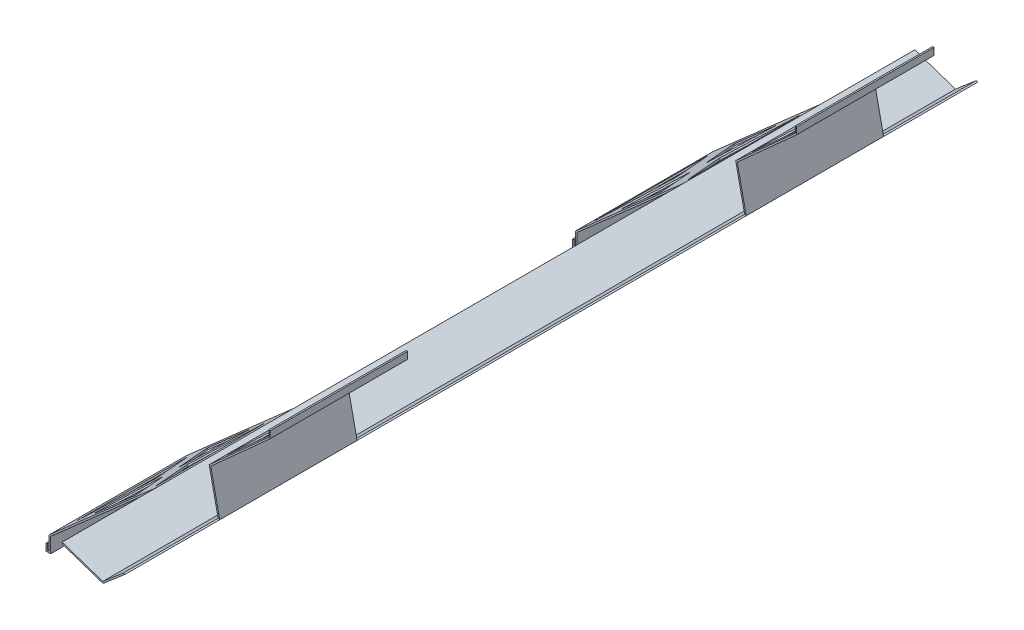
from build123d import *

# Parameters (mm, degrees)
BOSS_EXTRUDE1_DEPTH      = 480
CUT_EXTRUDE3_DEPTH       = 505
CUT_EXTRUDE3_DEPTH_BACK  = 505
BOSS_EXTRUDE2_DEPTH      = 1360
BOSS_EXTRUDE2_DEPTH_BACK = 810
BOSS_EXTRUDE3_DEPTH      = 480
BOSS_EXTRUDE4_DEPTH      = 330
CUT_EXTRUDE4_DEPTH       = 330
CUT_EXTRUDE4_DEPTH_BACK  = 330


with BuildPart() as part:
    # Sketch1 → Boss-Extrude1 (new body)
    with BuildSketch(Plane.XY):
        Polygon((11, 5), (11, 55), (386.170144681, 385.525887852), (528.318811029, 337.632708219), (601.499421829, 400.354983269), (570.353242625, 547.085741874), (778.485595709, 734.384763761), (778.549738756, 756.650357197), (783.549656083, 756.621450914), (783.378536091, 732.061448595), (575.84367641, 545.300113082), (607.006700625, 398.489997031), (529.415153906, 331.987158619), (387.309357719, 379.865894301), (16, 52.741369955), (16, 0), (0, 0), (0, 25), (5, 25), (5, 5), align=None)
    extrude(amount=BOSS_EXTRUDE1_DEPTH)

    # Sketch2 → Cut-Extrude3 (cut, two sides: drawn at the far end of the back side and taken through both)
    with BuildSketch(Plane(origin=(-16.817823624, 18.688475623, 0), x_dir=(0.7433298324443945, 0.6689250781651025, 0), z_dir=(-0.6689250781651025, 0.7433298324443945, 0)).offset(-CUT_EXTRUDE3_DEPTH_BACK)):
        Polygon((194.967507456, -40), (394.939723607, -40), (294.953615531, -213.181019237), align=None)
        Polygon((394.939723607, -440), (294.953615531, -266.818980763), (194.967507456, -440), align=None)
        Polygon((78.387816928, -38.078052875), (78.387816928, -441.921947125), (194.967507456, -240), align=None)
        Polygon((511.519414135, -441.921947125), (394.939723607, -240), (511.519414135, -38.078052875), align=None)
        Polygon((808.395249794, -38.078052875), (1044.692404937, -38.078052875), (926.543827366, -185.27928203), align=None)
        Polygon((1044.692404937, -441.921947125), (926.543827366, -294.72071797), (808.395249794, -441.921947125), align=None)
    extrude(amount=CUT_EXTRUDE3_DEPTH + CUT_EXTRUDE3_DEPTH_BACK, mode=Mode.SUBTRACT)

    # Sketch3 → Boss-Extrude2 (add, two sides: drawn at the far end of the back side and taken through both)
    with BuildSketch(Plane.XY.offset(480).offset(-BOSS_EXTRUDE2_DEPTH_BACK)):
        Polygon((386.170144681, 385.525887852), (528.318811029, 337.632708219), (601.499421829, 400.354983269), (607.006700625, 398.489997031), (529.415153906, 331.987158619), (387.309357719, 379.865894301), align=None)
    extrude(amount=BOSS_EXTRUDE2_DEPTH + BOSS_EXTRUDE2_DEPTH_BACK)

    # Sketch4 → Boss-Extrude3 (add)
    with BuildSketch(Plane.XY.offset(1840)):
        Polygon((0, 25), (5, 25), (5, 5), (11, 5), (11, 55), (386.170144681, 385.525887852), (528.318811029, 337.632708219), (601.499421829, 400.354983269), (570.353242625, 547.085741874), (778.485595709, 734.384763761), (778.549738756, 756.650357197), (783.549656083, 756.621450914), (783.378536091, 732.061448595), (575.84367641, 545.300113082), (607.006700625, 398.489997031), (529.415153906, 331.987158619), (387.309357719, 379.865894301), (16, 52.741369955), (16, 0), (0, 0), align=None)
    extrude(amount=BOSS_EXTRUDE3_DEPTH)

    # Sketch5 → Boss-Extrude4 (add)
    with BuildSketch(Plane.XY.offset(2320)):
        Polygon((386.170144681, 385.525887852), (528.318811029, 337.632708219), (601.499421829, 400.354983269), (607.006700625, 398.489997031), (529.415153906, 331.987158619), (387.309357719, 379.865894301), align=None)
    extrude(amount=BOSS_EXTRUDE4_DEPTH)

    # Sketch6 → Cut-Extrude4 (cut, two sides: drawn at the far end of the back side and taken through both)
    with BuildSketch(Plane(origin=(-22.473873985, 25.509428654, 0), x_dir=(0.7503402893619813, 0.6610517757030672, 0), z_dir=(-0.6610517757030672, 0.7503402893619813, 0)).offset(-CUT_EXTRUDE4_DEPTH_BACK)):
        Polygon((194.611590847, -1880), (394.611590847, -1880), (294.611590847, -2053.205080757), align=None)
        Polygon((294.611590847, -2106.794919243), (194.611590847, -2280), (394.611590847, -2280), align=None)
        Polygon((108.738430441, -1882.796854181), (222.593719764, -2080), (108.738430441, -2277.203145819), align=None)
        Polygon((366.629461929, -2080), (480.484751253, -2277.203145819), (480.484751253, -1882.796854181), align=None)
        Polygon((806.781697185, -1884.912116982), (1051.586264598, -1884.912116982), (929.183980892, -2037.422201681), align=None)
        Polygon((806.781697185, -2275.087883018), (1051.586264598, -2275.087883018), (929.183980892, -2122.577798319), align=None)
    extrude(amount=CUT_EXTRUDE4_DEPTH + CUT_EXTRUDE4_DEPTH_BACK, mode=Mode.SUBTRACT)


solid = part.part
